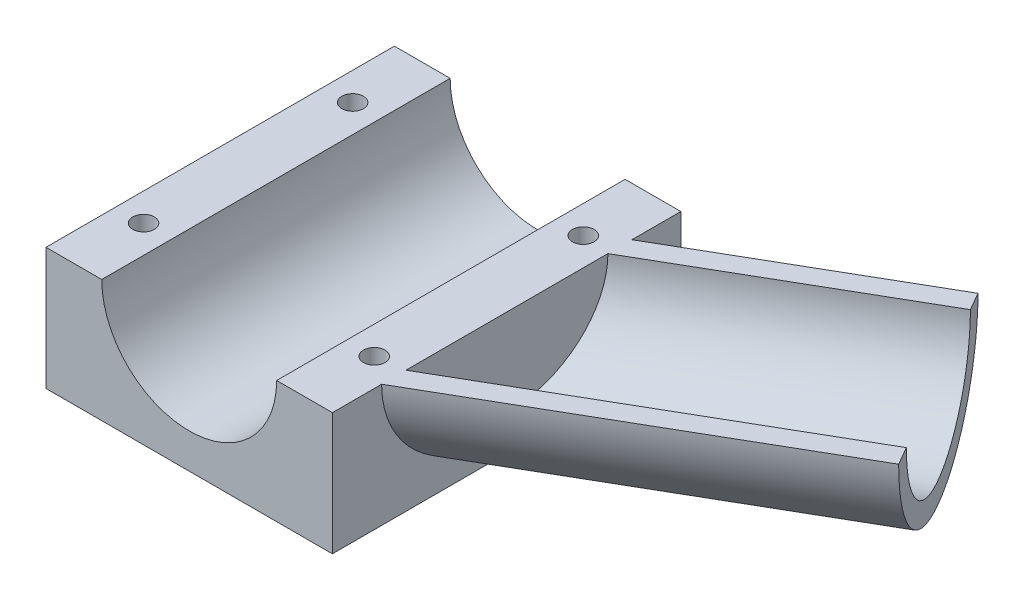
from build123d import *

# Parameters (mm, degrees)
BOSS_EXTRUDE1_DEPTH             = 25
SKETCH2_R                       = 1.55
CUT_EXTRUDE1_DEPTH              = 17.55
BOSS_EXTRUDE2_REACH             = 68.8
BOSS_EXTRUDE2_DIRECTION_2_DEPTH = 30
CUT_EXTRUDE2_REACH              = 80.635
CUT_EXTRUDE2_END_RADIUS         = 15.55
SKETCH6_R                       = 1.55


with BuildPart() as part:
    # Sketch1 → Boss-Extrude1 (new, symmetric)
    with BuildSketch(Plane.XY):
        with BuildLine():
            Line((-20.55, 17.55), (-20.55, 0))
            Line((-20.55, 0), (20.55, 0))
            Line((20.55, 0), (20.55, 17.55))
            Line((20.55, 17.55), (12.55, 17.55))
            ThreePointArc((12.55, 17.55), (0, 5), (-12.55, 17.55))
            Line((-12.55, 17.55), (-20.55, 17.55))
        make_face()
    extrude(amount=BOSS_EXTRUDE1_DEPTH, both=True)

    # Sketch2 → Cut-Extrude1 (cut)
    with BuildSketch(Plane(origin=(0, 17.55, 0), x_dir=(1, 0, 0), z_dir=(0, 1, 0))):
        with Locations(Location((-16.55, 15, 0), (0, 0, 270))):
            Circle(SKETCH2_R)
        with Locations(Location((16.55, 15, 0), (0, 0, 270))):
            Circle(SKETCH2_R)
        with Locations(Location((16.55, -15, 0), (0, 0, 270))):
            Circle(SKETCH2_R)
        with Locations(Location((-16.55, -15, 0), (0, 0, 270))):
            Circle(SKETCH2_R)
    extrude(amount=-CUT_EXTRUDE1_DEPTH, mode=Mode.SUBTRACT)

    # Boss-Extrude2: up to this plane
    boss_extrude2_end = Plane(origin=(20.55, 0, 25), z_dir=(-1, 0, 0))
    # Sketch5 → Boss-Extrude2 (add, up to the surface)
    with BuildSketch(Plane(origin=(28.704083189, 0, -16.572310156), x_dir=(-0.5000000000000017, 0, -0.8660254037844376), z_dir=(0.8660254037844377, 0, -0.5000000000000018)), mode=Mode.PRIVATE) as boss_extrude2_sk1:
        with BuildLine():
            Line((-25.804976237, 17.55), (-22.785176853, 17.55))
            ThreePointArc((-22.785176853, 17.55), (-10.235176853, 5), (2.314823147, 17.55))
            Line((2.314823147, 17.55), (5.295023763, 17.55))
            ThreePointArc((5.295023763, 17.55), (-10.254976237, 2), (-25.804976237, 17.55))
        make_face()
    boss_extrude2_tool1 = split(extrude(boss_extrude2_sk1.sketch, amount=-BOSS_EXTRUDE2_REACH, mode=Mode.PRIVATE), bisect_by=boss_extrude2_end, keep=Keep.BOTH, mode=Mode.PRIVATE)
    add(boss_extrude2_tool1.solids().sort_by_distance((40.851621, 17.202291, 4.467843))[0])

    # Sketch5 → Boss-Extrude2 direction 2 (add)
    with BuildSketch(Plane(origin=(28.704083189, 0, -16.572310156), x_dir=(-0.5000000000000017, 0, -0.8660254037844376), z_dir=(0.8660254037844377, 0, -0.5000000000000018))):
        with BuildLine():
            Line((-25.804976237, 17.55), (-22.785176853, 17.55))
            ThreePointArc((-22.785176853, 17.55), (-10.235176853, 5), (2.314823147, 17.55))
            Line((2.314823147, 17.55), (5.295023763, 17.55))
            ThreePointArc((5.295023763, 17.55), (-10.254976237, 2), (-25.804976237, 17.55))
        make_face()
    extrude(amount=BOSS_EXTRUDE2_DIRECTION_2_DEPTH)

    # Cut-Extrude2: up to this cylinder (the profile starts inside it)
    cut_extrude2_end = Plane(origin=(46.821952615, 17.55, -15.191240364), z_dir=(-0.8660254037844377, 0, 0.5000000000000017)) * Cylinder(CUT_EXTRUDE2_END_RADIUS, 193.37, mode=Mode.PRIVATE)
    # Sketch6 → Cut-Extrude2 (cut, up to the surface)
    with BuildSketch(Plane(origin=(0, 17.55, 0), x_dir=(1, 0, 0), z_dir=(0, 1, 0)), mode=Mode.PRIVATE) as cut_extrude2_sk1:
        with Locations(Location((46.812052672, 15.20838699, 0), (0, 0, 180))):
            Circle(SKETCH6_R)
    cut_extrude2_tool1 = extrude(cut_extrude2_sk1.sketch, amount=-CUT_EXTRUDE2_REACH, mode=Mode.PRIVATE) & cut_extrude2_end
    add(cut_extrude2_tool1.solids().sort_by_distance((46.812053, 17.55, -15.208387))[0], mode=Mode.SUBTRACT)


solid = part.part
